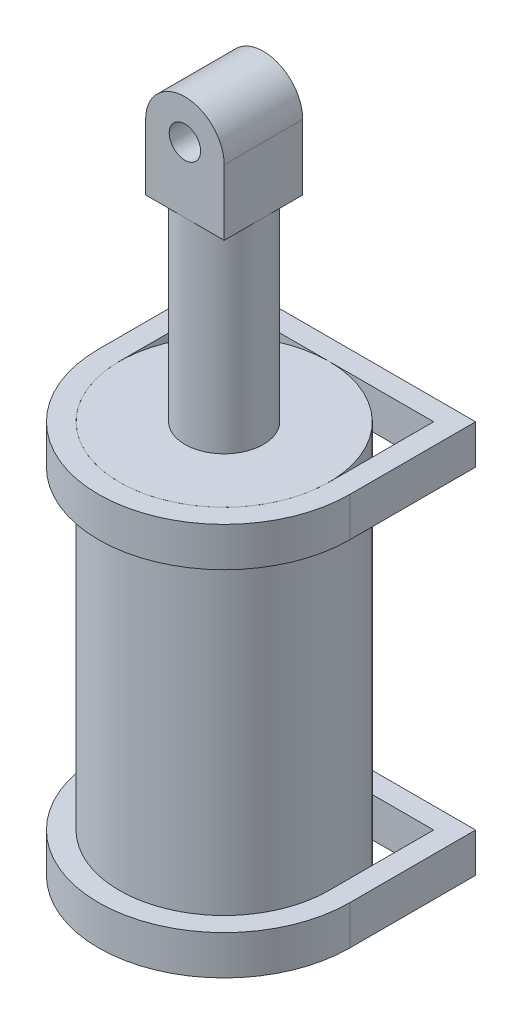
from build123d import *

# Parameters (mm, degrees)
SKETCH1_R               = 40
BOSS_EXTRUDE1_DEPTH     = 75
SKETCH2_R               = 15
BOSS_EXTRUDE2_DEPTH     = 75
SKETCH3_W               = 30
SKETCH3_H               = 30
BOSS_EXTRUDE3_DEPTH     = 25
BOSS_EXTRUDE4_DEPTH     = 30
CUT_EXTRUDE1_DEPTH      = 202.804360706
CUT_EXTRUDE1_DEPTH_BACK = 202.804360706
SKETCH5_R               = 6
BOSS_EXTRUDE6_DEPTH     = 15
BOSS_EXTRUDE8_DEPTH     = 15
SKETCH9_W               = 10
SKETCH9_H               = 15
CUT_EXTRUDE2_DEPTH      = 10
SKETCH10_W              = 10
SKETCH10_H              = 15
CUT_EXTRUDE3_DEPTH      = 10
SKETCH11_W              = 10
SKETCH11_H              = 15
CUT_EXTRUDE4_DEPTH      = 10
SKETCH12_W              = 10
SKETCH12_H              = 15
CUT_EXTRUDE5_DEPTH      = 10


with BuildPart() as part:
    # Sketch1 → Boss-Extrude1 (new, symmetric)
    with BuildSketch(Plane(origin=(0, 0, 0), x_dir=(1, 0, 0), z_dir=(0, 1, 0))):
        with Locations(Location((0, 0, 0), (0, 0, 270))):
            Circle(SKETCH1_R)
    extrude(amount=BOSS_EXTRUDE1_DEPTH, both=True)

    # Sketch2 → Boss-Extrude2 (add)
    with BuildSketch(Plane(origin=(0, 75, 0), x_dir=(1, 0, 0), z_dir=(0, 1, 0))):
        with Locations(Location((0, 0, 0), (0, 0, 270))):
            Circle(SKETCH2_R)
    extrude(amount=BOSS_EXTRUDE2_DEPTH)

    # Sketch3 → Boss-Extrude3 (add)
    with BuildSketch(Plane(origin=(0, 150, 0), x_dir=(1, 0, 0), z_dir=(0, 1, 0))):
        Rectangle(SKETCH3_W, SKETCH3_H)
    extrude(amount=BOSS_EXTRUDE3_DEPTH)

    # Sketch4 → Boss-Extrude4 (add)
    with BuildSketch(Plane.XY.offset(15)):
        with BuildLine():
            Line((-15, 175), (15, 175))
            ThreePointArc((15, 175), (0, 190), (-15, 175))
        make_face()
    extrude(amount=-BOSS_EXTRUDE4_DEPTH)

    # Sketch5 → Cut-Extrude1 (cut, two sides: drawn at the far end of the back side and taken through both)
    with BuildSketch(Plane.XY.offset(15).offset(-CUT_EXTRUDE1_DEPTH_BACK)):
        with Locations((0, 175)):
            Circle(SKETCH5_R)
    extrude(amount=CUT_EXTRUDE1_DEPTH + CUT_EXTRUDE1_DEPTH_BACK, mode=Mode.SUBTRACT)


with BuildPart() as body_2:
    # Sketch6 → Boss-Extrude6 (new body)
    with BuildSketch(Plane.XZ.offset(75)):
        with BuildLine():
            Line((-48, 0), (-48, -40))
            Line((-48, -40), (-58, -40))
            Line((-58, -40), (-58, -48))
            Line((-58, -48), (0, -48))
            Line((0, -48), (40, -48))
            Line((40, -48), (40, -58))
            Line((40, -58), (48, -58))
            Line((48, -58), (48, -40))
            Line((48, -40), (48, 0))
            ThreePointArc((48, 0), (0, 48), (-48, 0))
        make_face()
        with BuildLine():
            Line((-40, 0), (-40, -40))
            Line((-40, -40), (40, -40))
            Line((40, -40), (40, 0))
            ThreePointArc((40, 0), (0, 40), (-40, 0))
        make_face(mode=Mode.SUBTRACT)
    extrude(amount=-BOSS_EXTRUDE6_DEPTH)

    # Sketch9 → Cut-Extrude2 (cut)
    with BuildSketch(Plane.XY.offset(-40)):
        with Locations((-53, -67.5)):
            Rectangle(SKETCH9_W, SKETCH9_H)
    extrude(amount=-CUT_EXTRUDE2_DEPTH, mode=Mode.SUBTRACT)

    # Sketch12 → Cut-Extrude5 (cut)
    with BuildSketch(Plane.ZY.offset(-40)):
        with Locations((-53, -67.5)):
            Rectangle(SKETCH12_W, SKETCH12_H)
    extrude(amount=-CUT_EXTRUDE5_DEPTH, mode=Mode.SUBTRACT)


with BuildPart() as body_3:
    # Sketch7 → Boss-Extrude8 (new body)
    with BuildSketch(Plane(origin=(0, 75, 0), x_dir=(1, 0, 0), z_dir=(0, 1, 0))):
        with BuildLine():
            Line((48, 0), (48, 58))
            Line((48, 58), (40, 58))
            Line((40, 58), (40, 48))
            Line((40, 48), (-58, 48))
            Line((-58, 48), (-58, 40))
            Line((-58, 40), (-48, 40))
            Line((-48, 40), (-48, 0))
            ThreePointArc((-48, 0), (0, -48), (48, 0))
        make_face()
        with BuildLine():
            Line((40, 40), (40, 0))
            ThreePointArc((40, 0), (0, -40), (-40, 0))
            Line((-40, 0), (-40, 40))
            Line((-40, 40), (40, 40))
        make_face(mode=Mode.SUBTRACT)
    extrude(amount=-BOSS_EXTRUDE8_DEPTH)

    # Sketch10 → Cut-Extrude3 (cut)
    with BuildSketch(Plane.XY.offset(-40)):
        with Locations((-53, 67.5)):
            Rectangle(SKETCH10_W, SKETCH10_H)
    extrude(amount=-CUT_EXTRUDE3_DEPTH, mode=Mode.SUBTRACT)

    # Sketch11 → Cut-Extrude4 (cut)
    with BuildSketch(Plane.ZY.offset(-40)):
        with Locations((-53, 67.5)):
            Rectangle(SKETCH11_W, SKETCH11_H)
    extrude(amount=-CUT_EXTRUDE4_DEPTH, mode=Mode.SUBTRACT)


solid = Compound([part.part, body_2.part, body_3.part])
